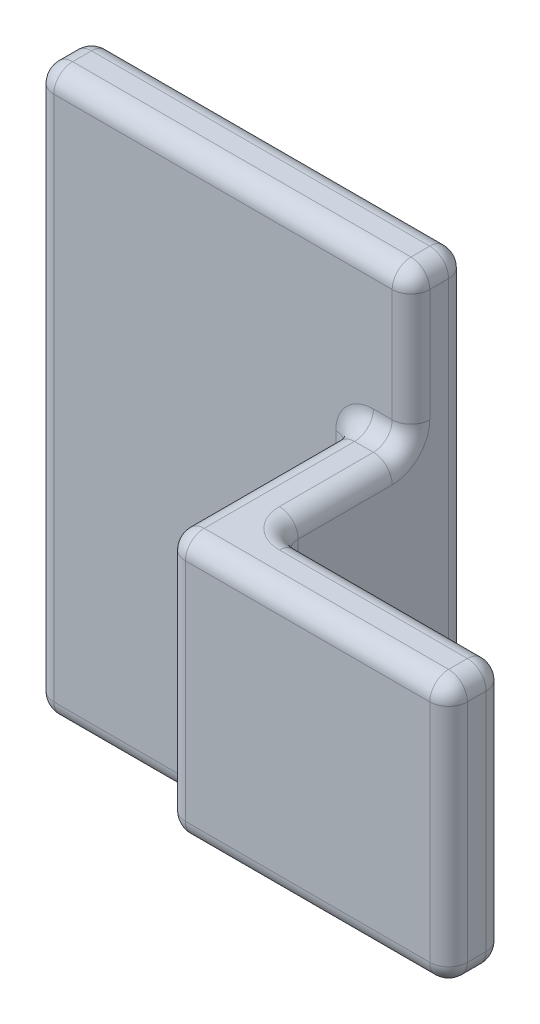
from build123d import *

# Parameters (mm, degrees)
SKETCH1_W           = 20
SKETCH1_H           = 30
BOSS_EXTRUDE1_DEPTH = 3
SKETCH3_W           = 10
SKETCH3_H           = 14
BOSS_EXTRUDE2_DEPTH = 3
SKETCH4_W           = 3
SKETCH4_H           = 14
BOSS_EXTRUDE3_DEPTH = 15
FILLET1_R           = 1
FILLET2_R           = 1


with BuildPart() as part:
    # Sketch1 → Boss-Extrude1 (new body)
    with BuildSketch(Plane.XY):
        with Locations((10, -15)):
            Rectangle(SKETCH1_W, SKETCH1_H)
    extrude(amount=BOSS_EXTRUDE1_DEPTH)

    # Sketch3 → Boss-Extrude2 (add)
    with BuildSketch(Plane.ZY.offset(-20)):
        with Locations((8, -15)):
            Rectangle(SKETCH3_W, SKETCH3_H)
    extrude(amount=BOSS_EXTRUDE2_DEPTH)

    # Sketch4 → Boss-Extrude3 (add)
    with BuildSketch(Plane.ZY.offset(-17)):
        with Locations((11.5, -15)):
            Rectangle(SKETCH4_W, SKETCH4_H)
    extrude(amount=-BOSS_EXTRUDE3_DEPTH)

    # Fillet1
    fillet1_edges = [part.edges().sort_by_distance(p)[0] for p in [
        (20, -4, 3),
        (18.5, -8, 3),
        (20, -22, 6.5),
        (18.5, -22, 3),
        (24.5, -22, 13),
        (24.5, -8, 13),
        (17, -15, 3),
        (17, -22, 8),
        (17, -15, 13),
        (17, -8, 8),
        (20, -8, 6.5),
        (32, -15, 13),
        (32, -22, 11.5),
        (32, -15, 10),
        (26, -22, 10),
        (32, -8, 11.5),
        (26, -8, 10),
        (20, -15, 10),
        (20, -26, 3),
    ]]
    fillet(fillet1_edges, radius=FILLET1_R)

    # Fillet2
    fillet2_edges = [part.edges().sort_by_distance(p)[0] for p in [
        (0, -15, 3),
        (9.5, 0, 3),
        (9.5, -30, 3),
        (0, -15, 0),
        (20, -30, 1),
        (20, 0, 1),
        (10, 0, 0),
        (19.707106781, -30, 2.707106781),
        (19.707106781, 0, 2.707106781),
        (20, -15, 0),
        (10, -30, 0),
        (0, -30, 1.5),
        (0, 0, 1.5),
    ]]
    fillet(fillet2_edges, radius=FILLET2_R)


solid = part.part
